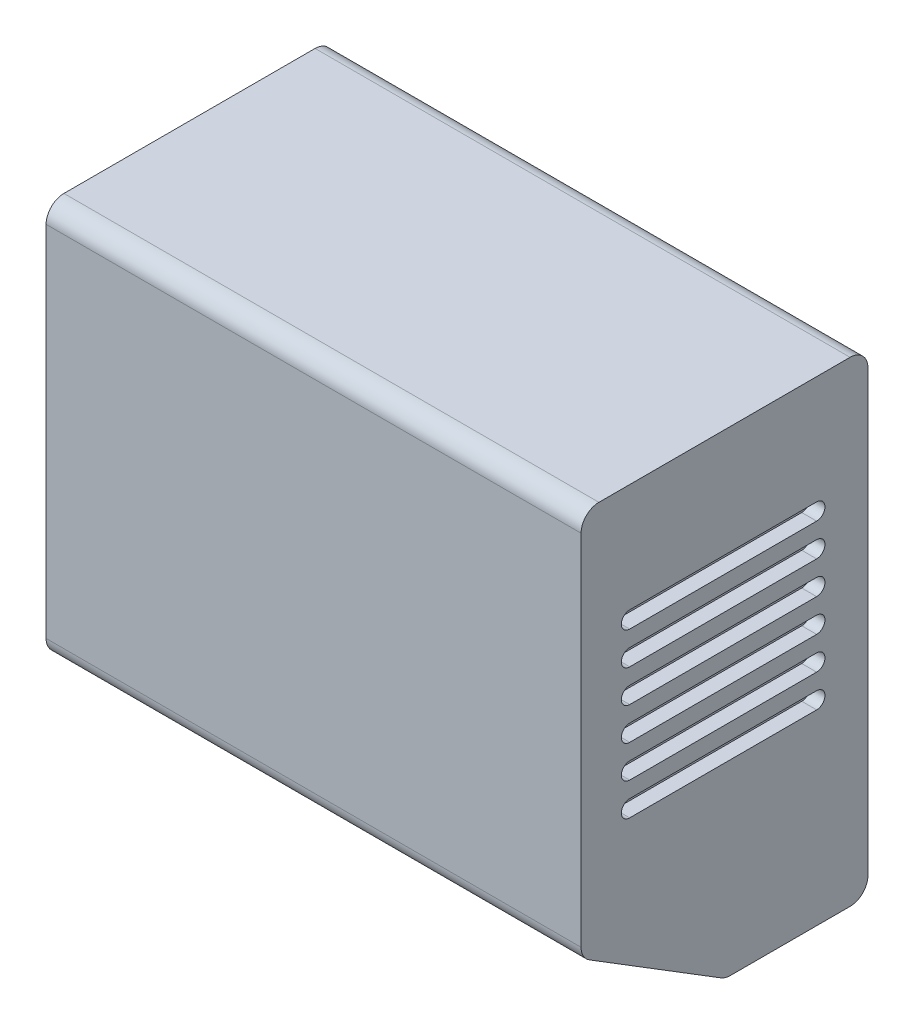
from build123d import *

# Parameters (mm, degrees)
BOSS_EXTRU_1_DEPTH         = 45
BOSS_EXTRU_1_DEPTH_BACK    = 45
CONG_1_R                   = 3
ENL_V_MAT_EXTRU_1_DEPTH    = 2.5
R_P_TITION_LIN_AIRE1_COUNT = 6
R_P_TITION_LIN_AIRE1_PITCH = 5.5
SYM_TRIE1_COPY_1_DEPTH     = 2.5
SYM_TRIE1_COPY_2_DEPTH     = 2.5
SYM_TRIE1_COPY_3_DEPTH     = 2.5
SYM_TRIE1_COPY_4_DEPTH     = 2.5
SYM_TRIE1_COPY_5_DEPTH     = 2.5
SYM_TRIE1_COPY_6_DEPTH     = 2.5


with BuildPart() as part:
    # Esquisse1 → Boss.-Extru.1 (new, two sides: drawn at the far end of the back side and taken through both)
    with BuildSketch(Plane(origin=(0, 0, 0), x_dir=(0, 0, -1), z_dir=(1, 0, 0)).offset(-BOSS_EXTRU_1_DEPTH_BACK)):
        Polygon((-48.25, 40), (0, 40), (0, 0), (0, -40), (-24, -40), (-48.25, -25), align=None)
    extrude(amount=BOSS_EXTRU_1_DEPTH + BOSS_EXTRU_1_DEPTH_BACK)

    # Congé1
    cong_1_edges = [part.edges().sort_by_distance(p)[0] for p in [
        (0, -40, 24),
        (0, -25, 48.25),
        (0, -40, 0),
        (0, 40, 0),
        (0, 40, 48.25),
    ]]
    fillet(cong_1_edges, radius=CONG_1_R)

    # Esquisse2 → Enlèv. mat.-Extru.1 (cut)
    with BuildSketch(Plane(origin=(45, 0, 0), x_dir=(0, 0, -1), z_dir=(1, 0, 0))):
        with BuildLine():
            Line((-40.074077662, 21.746799664), (-8.626027221, 21.746799664))
            ThreePointArc((-8.626027221, 21.746799664), (-7.226027221, 20.346799664), (-8.626027221, 18.946799664))
            Line((-8.626027221, 18.946799664), (-40.074077662, 18.946799664))
            ThreePointArc((-40.074077662, 18.946799664), (-41.474077662, 20.346799664), (-40.074077662, 21.746799664))
        make_face()
    enl_v_mat_extru_1 = extrude(amount=-ENL_V_MAT_EXTRU_1_DEPTH, mode=Mode.SUBTRACT)

    # Répétition linéaire1: Enlèv. mat.-Extru.1 ×6
    with Locations(*[(0, -i * R_P_TITION_LIN_AIRE1_PITCH, 0) for i in range(1, R_P_TITION_LIN_AIRE1_COUNT)]):
        add(enl_v_mat_extru_1, mode=Mode.SUBTRACT)

    # Symétrie1 copy 1 sketch → Symétrie1 copy 1 (cut)
    with BuildSketch(Plane(origin=(-45, -5.5, 0), x_dir=(0, 0, -1), z_dir=(-1, 0, 0))):
        with BuildLine():
            Line((-40.074077662, -21.746799664), (-8.626027221, -21.746799664))
            ThreePointArc((-8.626027221, -21.746799664), (-7.226027221, -20.346799664), (-8.626027221, -18.946799664))
            Line((-8.626027221, -18.946799664), (-40.074077662, -18.946799664))
            ThreePointArc((-40.074077662, -18.946799664), (-41.474077662, -20.346799664), (-40.074077662, -21.746799664))
        make_face()
    extrude(amount=-SYM_TRIE1_COPY_1_DEPTH, mode=Mode.SUBTRACT)

    # Symétrie1 copy 2 sketch → Symétrie1 copy 2 (cut)
    with BuildSketch(Plane(origin=(-45, -11, 0), x_dir=(0, 0, -1), z_dir=(-1, 0, 0))):
        with BuildLine():
            Line((-40.074077662, -21.746799664), (-8.626027221, -21.746799664))
            ThreePointArc((-8.626027221, -21.746799664), (-7.226027221, -20.346799664), (-8.626027221, -18.946799664))
            Line((-8.626027221, -18.946799664), (-40.074077662, -18.946799664))
            ThreePointArc((-40.074077662, -18.946799664), (-41.474077662, -20.346799664), (-40.074077662, -21.746799664))
        make_face()
    extrude(amount=-SYM_TRIE1_COPY_2_DEPTH, mode=Mode.SUBTRACT)

    # Symétrie1 copy 3 sketch → Symétrie1 copy 3 (cut)
    with BuildSketch(Plane(origin=(-45, -16.5, 0), x_dir=(0, 0, -1), z_dir=(-1, 0, 0))):
        with BuildLine():
            Line((-40.074077662, -21.746799664), (-8.626027221, -21.746799664))
            ThreePointArc((-8.626027221, -21.746799664), (-7.226027221, -20.346799664), (-8.626027221, -18.946799664))
            Line((-8.626027221, -18.946799664), (-40.074077662, -18.946799664))
            ThreePointArc((-40.074077662, -18.946799664), (-41.474077662, -20.346799664), (-40.074077662, -21.746799664))
        make_face()
    extrude(amount=-SYM_TRIE1_COPY_3_DEPTH, mode=Mode.SUBTRACT)

    # Symétrie1 copy 4 sketch → Symétrie1 copy 4 (cut)
    with BuildSketch(Plane(origin=(-45, -22, 0), x_dir=(0, 0, -1), z_dir=(-1, 0, 0))):
        with BuildLine():
            Line((-40.074077662, -21.746799664), (-8.626027221, -21.746799664))
            ThreePointArc((-8.626027221, -21.746799664), (-7.226027221, -20.346799664), (-8.626027221, -18.946799664))
            Line((-8.626027221, -18.946799664), (-40.074077662, -18.946799664))
            ThreePointArc((-40.074077662, -18.946799664), (-41.474077662, -20.346799664), (-40.074077662, -21.746799664))
        make_face()
    extrude(amount=-SYM_TRIE1_COPY_4_DEPTH, mode=Mode.SUBTRACT)

    # Symétrie1 copy 5 sketch → Symétrie1 copy 5 (cut)
    with BuildSketch(Plane(origin=(-45, -27.5, 0), x_dir=(0, 0, -1), z_dir=(-1, 0, 0))):
        with BuildLine():
            Line((-40.074077662, -21.746799664), (-8.626027221, -21.746799664))
            ThreePointArc((-8.626027221, -21.746799664), (-7.226027221, -20.346799664), (-8.626027221, -18.946799664))
            Line((-8.626027221, -18.946799664), (-40.074077662, -18.946799664))
            ThreePointArc((-40.074077662, -18.946799664), (-41.474077662, -20.346799664), (-40.074077662, -21.746799664))
        make_face()
    extrude(amount=-SYM_TRIE1_COPY_5_DEPTH, mode=Mode.SUBTRACT)

    # Symétrie1 copy 6 sketch → Symétrie1 copy 6 (cut)
    with BuildSketch(Plane(origin=(-45, 0, 0), x_dir=(0, 0, -1), z_dir=(-1, 0, 0))):
        with BuildLine():
            Line((-40.074077662, -21.746799664), (-8.626027221, -21.746799664))
            ThreePointArc((-8.626027221, -21.746799664), (-7.226027221, -20.346799664), (-8.626027221, -18.946799664))
            Line((-8.626027221, -18.946799664), (-40.074077662, -18.946799664))
            ThreePointArc((-40.074077662, -18.946799664), (-41.474077662, -20.346799664), (-40.074077662, -21.746799664))
        make_face()
    extrude(amount=-SYM_TRIE1_COPY_6_DEPTH, mode=Mode.SUBTRACT)


solid = part.part
